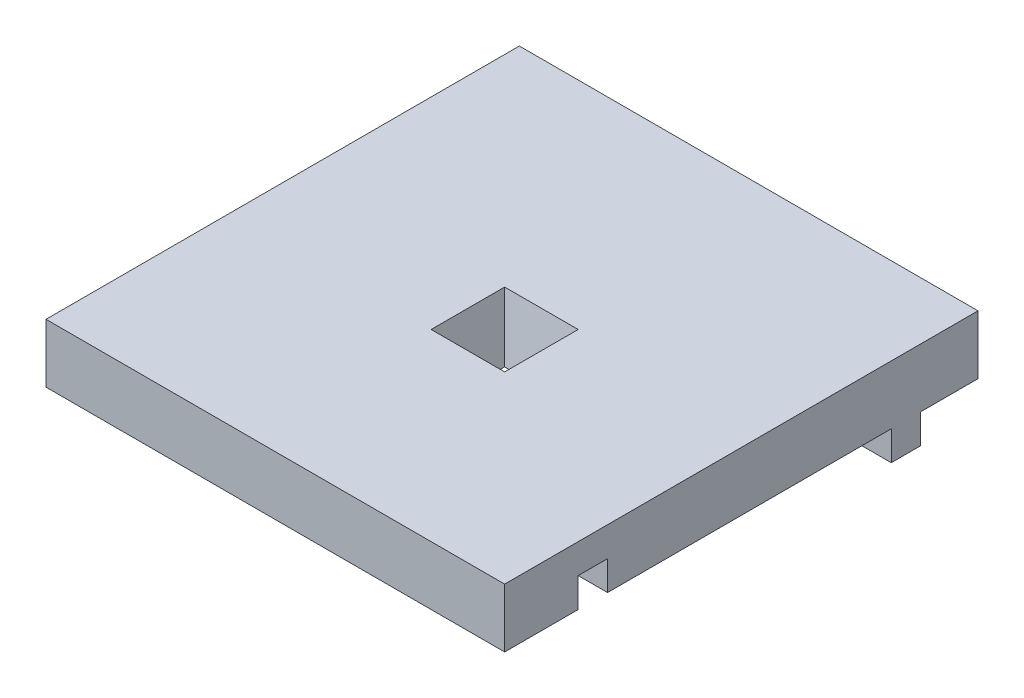
from build123d import *

# Parameters (mm, degrees)
SKETCH1_W          = 31.2
SKETCH1_H          = 32.2
BODY_DEPTH         = 4
SKETCH2_W          = 2
SKETCH2_H          = 2
FEMALE_TABS_DEPTH  = 2
SKETCH3_W          = 2
SKETCH3_H          = 2
MALE_TABS_DEPTH    = 2
SKETCH4_W          = 5
SKETCH4_H          = 5
CUT_EXTRUDE2_DEPTH = 4
CUT_EXTRUDE2_DRAFT = -10


with BuildPart() as part:
    # Sketch1 → Body (new body)
    with BuildSketch(Plane(origin=(0, 0, 0), x_dir=(1, 0, 0), z_dir=(0, 1, 0))):
        with Locations((15.6, -16.1)):
            Rectangle(SKETCH1_W, SKETCH1_H)
    extrude(amount=BODY_DEPTH)

    # Sketch2 → Female Tabs (cut)
    with BuildSketch(Plane(origin=(0, 0, 0), x_dir=(-1, 0, 0), z_dir=(0, -1, 0))):
        with Locations((-1, -4.9)):
            Rectangle(SKETCH2_W, SKETCH2_H)
        with Locations((-30.2, -26.2)):
            Rectangle(SKETCH2_W, SKETCH2_H)
    extrude(amount=-FEMALE_TABS_DEPTH, mode=Mode.SUBTRACT)

    # Sketch3 → Male Tabs (add)
    with BuildSketch(Plane(origin=(0, 0, 0), x_dir=(-1, 0, 0), z_dir=(0, -1, 0))):
        with Locations((-1, -26.2)):
            Rectangle(SKETCH3_W, SKETCH3_H)
        with Locations((-30.2, -4.9)):
            Rectangle(SKETCH3_W, SKETCH3_H)
    extrude(amount=MALE_TABS_DEPTH)


with BuildPart() as cut_extrude2_tool:
    # Sketch4 → Cut-Extrude2 (with draft: the straight prism first)
    with BuildSketch(Plane(origin=(0, 4, 0), x_dir=(1, 0, 0), z_dir=(0, 1, 0))):
        with Locations((16.2, -17.2)):
            Rectangle(SKETCH4_W, SKETCH4_H)
    extrude(amount=-CUT_EXTRUDE2_DEPTH)
    # Cut-Extrude2: the draft: its side faces are tilted about the plane it starts from
    cut_extrude2_sides = [cut_extrude2_tool.faces().sort_by_distance(p)[0] for p in [
        (18.7, 2, 17.2),
        (16.2, 2, 14.7),
        (13.7, 2, 17.2),
        (16.2, 2, 19.7),
    ]]
    draft(cut_extrude2_sides, Plane(origin=(0, 4, 0), x_dir=(1, 0, 0), z_dir=(0, 1, 0)), CUT_EXTRUDE2_DRAFT)


with BuildPart() as part_1:
    add(part.part)

    # Cut-Extrude2: cut by cut_extrude2_tool
    add(cut_extrude2_tool.part, mode=Mode.SUBTRACT)


solid = part_1.part
